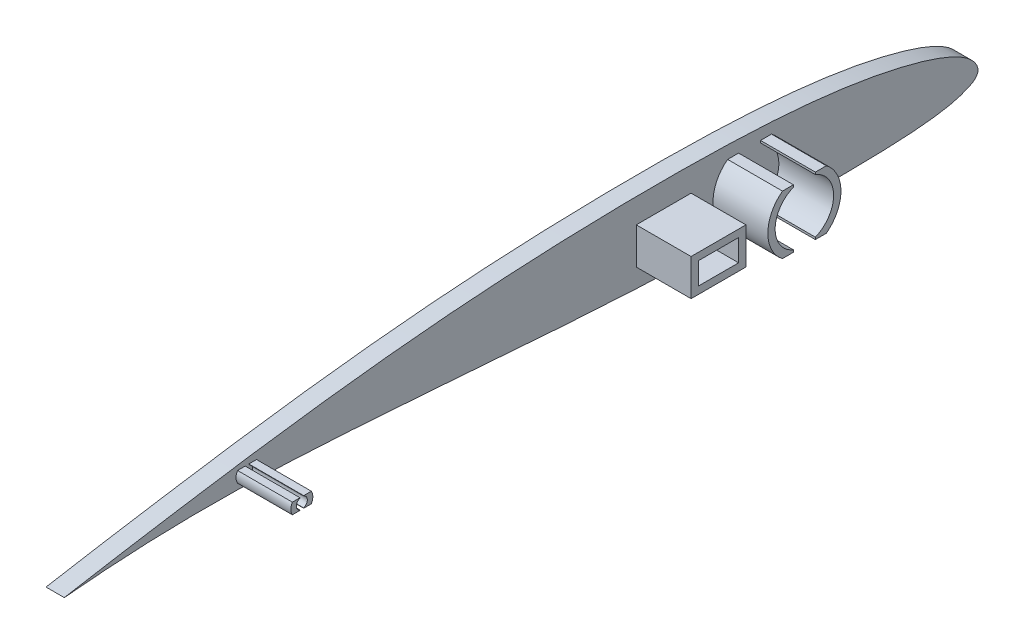
from build123d import *

# Parameters (mm, degrees)
CORPOFOAM_DEPTH              = 5
PERNOAGGANCIOALETTONE_DEPTH  = 15
SCHIZZO4_W                   = 15
SCHIZZO4_H                   = 10
SCHIZZO4_W_2                 = 11
SCHIZZO4_H_2                 = 6
ESTRUSIONE_ESTRUSIONE1_DEPTH = 20


with BuildPart() as part:
    # Schizzo1 → CorpoFoam (new body)
    with BuildSketch(Plane(origin=(0, 0, 0), x_dir=(0, 0, -1), z_dir=(1, 0, 0))):
        with BuildLine():
            add(Edge.make_bspline(
                [(-250, 0), (-250.000228294, -0.008042796), (-248.284955516, 0.172375658), (-246.518112419, 0.308690015), (-242.189387343, 0.685693594), (-236.806461263, 1.074101529), (-229.680385952, 1.49731724), (-221.184158698, 1.823218603), (-211.337618208, 1.967626101), (-200.371188527, 1.833221056), (-188.499913622, 1.38960529), (-175.953687417, 0.706014078), (-162.931424918, -0.160208642), (-149.615771744, -1.148016327), (-136.176354995, -2.19092491), (-122.767140548, -3.219583979), (-109.520053587, -4.152743127), (-96.546095975, -4.938564365), (-83.940819302, -5.536830703), (-71.801839291, -5.947648205), (-60.245256003, -6.218450939), (-49.398732891, -6.355369756), (-39.397226194, -6.381387963), (-30.361934842, -6.26504923), (-22.412181103, -6.012164917), (-15.626227231, -5.597433901), (-10.071907511, -4.928706579), (-5.697692612, -4.040446981), (-2.625320639, -2.865752984), (-0.494884225, -1.71152847), (0.021312549, -0.410454231), (-0.0311692, 0.792659827), (-0.812599242, 2.305684337), (-2.728863517, 4.238352424), (-5.769907241, 6.118172121), (-9.880942804, 7.913594202), (-15.074930468, 9.641318178), (-21.298752222, 11.283896488), (-28.49717212, 12.788381759), (-36.607373406, 14.097834908), (-45.57302844, 15.159429017), (-55.332910074, 15.960903998), (-65.816536498, 16.494069738), (-76.93137626, 16.791989705), (-88.566949028, 16.864754131), (-100.596999886, 16.726715291), (-112.888825982, 16.383385064), (-125.311615819, 15.825573667), (-137.743791097, 15.05233187), (-150.072384382, 14.059339074), (-162.191375056, 12.881586986), (-173.989074322, 11.549280346), (-185.352364446, 10.116249729), (-196.163081698, 8.632379125), (-206.300441402, 7.131513884), (-215.560350587, 5.731221768), (-223.977157043, 4.293295127), (-231.363413336, 3.181808874), (-237.746440904, 2.098942417), (-242.622069366, 1.245861917), (-246.644529332, 0.552864946), (-248.32839844, 0.246216765), (-249.999773563, 0.007977377), (-250, 0)],
                knots=[0, 0, 0, 0, 0.001588889, 0.006329218, 0.014202456, 0.025172808, 0.039173483, 0.056060631, 0.075578924, 0.097363607, 0.120926258, 0.145825281, 0.171670912, 0.198108537, 0.224790184, 0.25139058, 0.277643491, 0.30332675, 0.328257458, 0.352272548, 0.375156062, 0.396620664, 0.416422729, 0.43430442, 0.45005468, 0.463465465, 0.474478994, 0.483169222, 0.489678354, 0.494104066, 0.496910015, 0.497289785, 0.501214273, 0.50645795, 0.513356957, 0.522168632, 0.53296597, 0.545689209, 0.560220779, 0.576438923, 0.594258689, 0.613600245, 0.634342386, 0.656331109, 0.679351894, 0.703152303, 0.727478208, 0.752070739, 0.776691164, 0.801140184, 0.825214387, 0.848697424, 0.871352858, 0.892947449, 0.913230871, 0.931955467, 0.948342069, 0.963693004, 0.976235918, 0.986320059, 0.993788799, 0.998424035, 1, 1, 1, 1], degree=3))
        make_face()
    extrude(amount=CORPOFOAM_DEPTH)

    # Schizzo3 → PernoAggancioAlettone (add)
    with BuildSketch(Plane(origin=(5, 0, 0), x_dir=(0, 0, -1), z_dir=(1, 0, 0))):
        with BuildLine():
            Line((-197.401923789, 6.41748059), (-199.5, 6.41748059))
            Line((-199.5, 6.41748059), (-199.5, 6.331694152))
            ThreePointArc((-199.5, 6.331694152), (-198.5, 4.91748059), (-199.5, 3.503267027))
            Line((-199.5, 3.503267027), (-199.5, 3.41748059))
            Line((-199.5, 3.41748059), (-197.401923789, 3.41748059))
            ThreePointArc((-197.401923789, 3.41748059), (-197, 4.91748059), (-197.401923789, 6.41748059))
        make_face()
        with BuildLine():
            Line((-200.5, 6.41748059), (-200.5, 6.331694152))
            ThreePointArc((-200.5, 6.331694152), (-201.5, 4.91748059), (-200.5, 3.503267027))
            Line((-200.5, 3.503267027), (-200.5, 3.41748059))
            Line((-200.5, 3.41748059), (-202.598076211, 3.41748059))
            ThreePointArc((-202.598076211, 3.41748059), (-203, 4.91748059), (-202.598076211, 6.41748059))
            Line((-202.598076211, 6.41748059), (-200.5, 6.41748059))
        make_face()
    extrude(amount=PERNOAGGANCIOALETTONE_DEPTH)

    # Schizzo4 → Estrusione-Estrusione1 (add)
    # profile 1 of 3: a face of its own
    with BuildSketch(Plane.ZY):
        with BuildLine():
            Line((56.499919709, 13.077322704), (59.499919709, 13.077322704))
            Line((59.499919709, 13.077322704), (59.499919709, 12.493521191))
            ThreePointArc((59.499919709, 12.493521191), (54.499919709, 5.077322704), (59.499919709, -2.338875783))
            Line((59.499919709, -2.338875783), (59.499919709, -2.922677296))
            Line((59.499919709, -2.922677296), (56.499919709, -2.922677296))
            ThreePointArc((56.499919709, -2.922677296), (52.499919709, 5.077322704), (56.499919709, 13.077322704))
        make_face()
    # profile 2 of 3: a face of its own
    with BuildSketch(Plane.ZY):
        with Locations((85.999919709, 5.077322704)):
            Rectangle(SCHIZZO4_W, SCHIZZO4_H)
        with Locations((85.999919709, 5.077322704)):
            Rectangle(SCHIZZO4_W_2, SCHIZZO4_H_2, mode=Mode.SUBTRACT)
    # profile 3 of 3: a face of its own
    with BuildSketch(Plane.ZY):
        with BuildLine():
            Line((65.499919709, 13.077322704), (65.499919709, 12.493521191))
            ThreePointArc((65.499919709, 12.493521191), (70.499919709, 5.077322704), (65.499919709, -2.338875783))
            Line((65.499919709, -2.338875783), (65.499919709, -2.922677296))
            Line((65.499919709, -2.922677296), (68.499919709, -2.922677296))
            ThreePointArc((68.499919709, -2.922677296), (72.499919709, 5.077322704), (68.499919709, 13.077322704))
            Line((68.499919709, 13.077322704), (65.499919709, 13.077322704))
        make_face()
    extrude(amount=-ESTRUSIONE_ESTRUSIONE1_DEPTH)


solid = part.part
